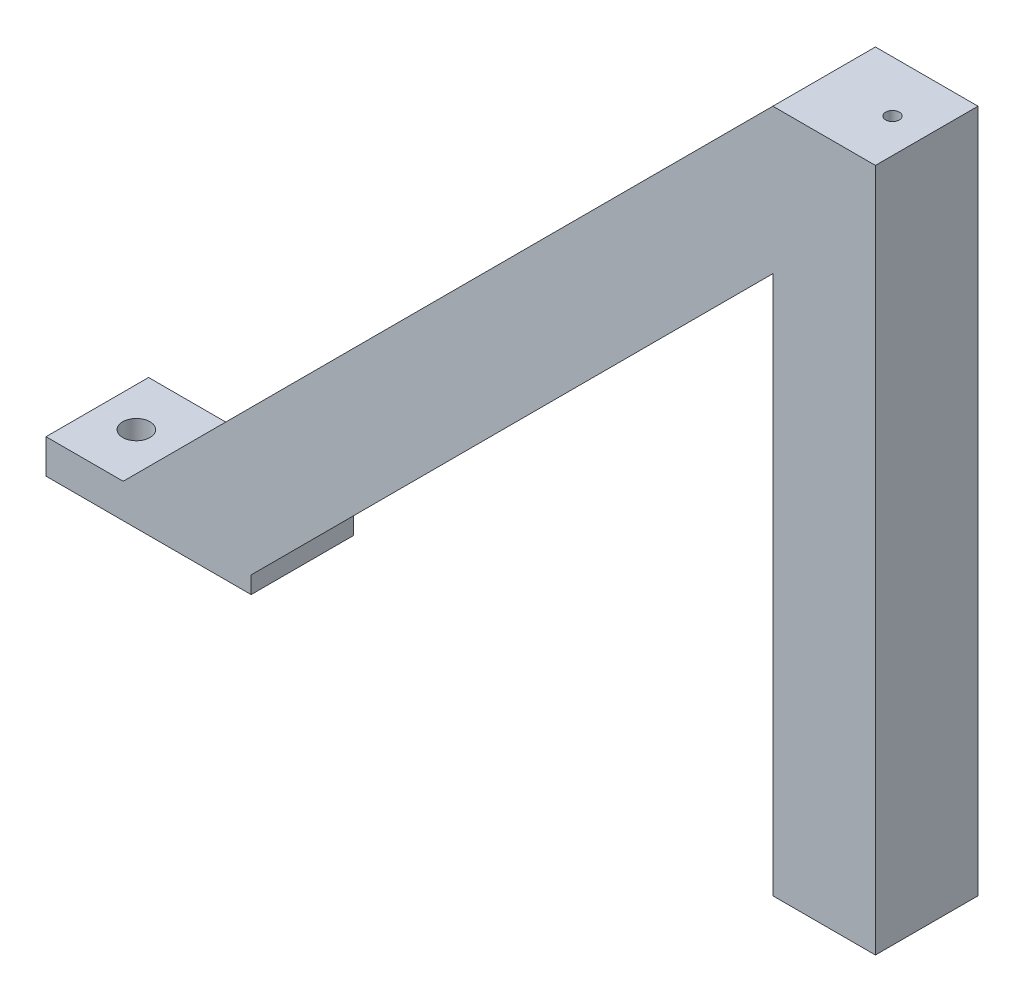
from build123d import *

# Parameters (mm, degrees)
BOSS_EXTRUDE1_DEPTH = 9.525
SKETCH3_R           = 1.27
CUT_EXTRUDE1_DEPTH  = 6.35
SKETCH4_W           = 38.1
SKETCH4_H           = 6.35
BOSS_EXTRUDE2_DEPTH = 19.05
SKETCH5_R           = 2.54
CUT_EXTRUDE3_DEPTH  = 9.525


with BuildPart() as part:
    # Sketch2 → Boss-Extrude1 (new, symmetric)
    with BuildSketch(Plane.XY):
        Polygon((0, 127), (-19.05, 127), (-142.875, 3.175), (-115.934231637, 3.175), (-19.05, 100.059231637), (-19.05, 0), (0, 0), align=None)
    extrude(amount=BOSS_EXTRUDE1_DEPTH, both=True)

    # Sketch3 → Cut-Extrude1 (cut)
    with BuildSketch(Plane(origin=(0, 127, 0), x_dir=(1, 0, 0), z_dir=(0, 1, 0))):
        with Locations(Location((-6.35, 0, 0), (0, 0, 270))):
            Circle(SKETCH3_R)
    extrude(amount=-CUT_EXTRUDE1_DEPTH, mode=Mode.SUBTRACT)

    # Sketch4 → Boss-Extrude2 (add)
    with BuildSketch(Plane.XY.offset(9.525)):
        with Locations((-134.984231637, 3.175)):
            Rectangle(SKETCH4_W, SKETCH4_H)
    extrude(amount=-BOSS_EXTRUDE2_DEPTH)

    # Sketch5 → Cut-Extrude3 (cut)
    with BuildSketch(Plane(origin=(0, 6.35, 0), x_dir=(1, 0, 0), z_dir=(0, 1, 0))):
        with Locations(Location((-146.779052356, 0, 0), (0, 0, 180))):
            Circle(SKETCH5_R)
    extrude(amount=-CUT_EXTRUDE3_DEPTH, mode=Mode.SUBTRACT)


solid = part.part
